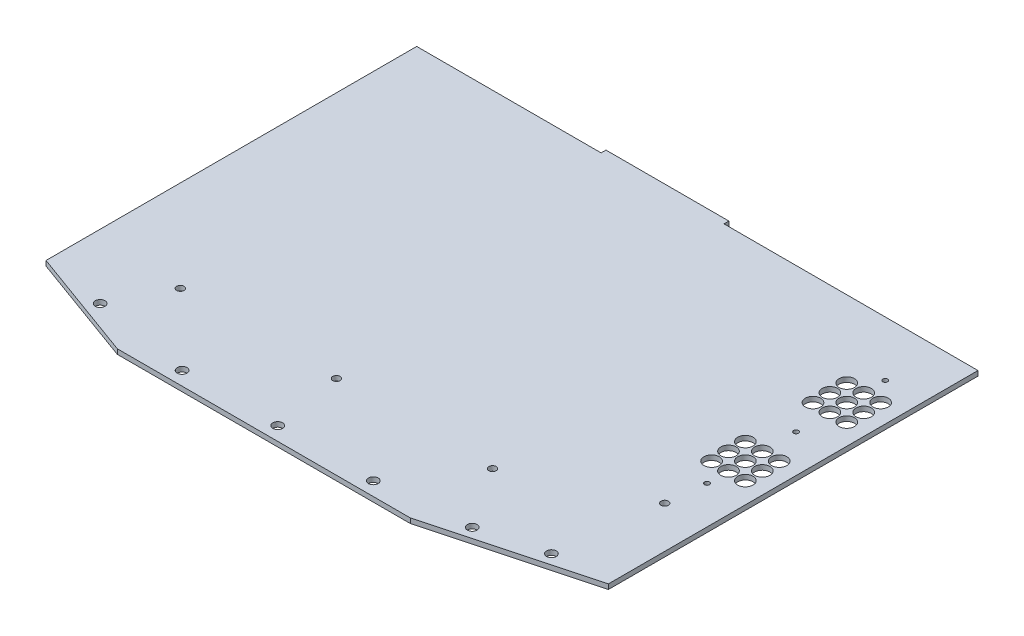
from build123d import *

# Parameters (mm, degrees)
SKETCH1_W            = 308.08168
SKETCH1_H            = 3.175
BOSS_EXTRUDE1_DEPTH  = 267.83
SKETCH3_W            = 267.83
SKETCH3_H            = 3.175
BOSS_EXTRUDE3_DEPTH  = 3.175
SKETCH4_W            = 50.8889
SKETCH4_H            = 3.175
BOSS_EXTRUDE4_DEPTH  = 267.83
CUT_EXTRUDE1_DEPTH   = 340.191055801
SKETCH17_W           = 267.83
SKETCH17_H           = 3.175
BOSS_EXTRUDE5_DEPTH  = 3.175
CUT_EXTRUDE3_DEPTH   = 340.191055801
SKETCH25_R           = 3.175
CUT_EXTRUDE8_DEPTH   = 3.175
SKETCH27_R           = 5
CUT_EXTRUDE9_DEPTH   = 340.191055801
SKETCH30_W           = 80
SKETCH30_H           = 3.175
BOSS_EXTRUDE6_DEPTH  = 3.175
SKETCH31_R           = 1.5875
CUT_EXTRUDE10_DEPTH  = 340.191055801
LPATTERN1_COUNT      = 3
LPATTERN1_PITCH      = 58
M4_CLEARANCE_HOLE1_D = 4.8


with BuildPart() as part:
    # Sketch1 → Boss-Extrude1 (new body)
    with BuildSketch(Plane.XY):
        Rectangle(SKETCH1_W, SKETCH1_H)
    extrude(amount=BOSS_EXTRUDE1_DEPTH)

    # Sketch3 → Boss-Extrude3 (add)
    with BuildSketch(Plane(origin=(154.04084, 0, 0), x_dir=(0, 0, -1), z_dir=(1, 0, 0))):
        with Locations((-133.915, 0)):
            Rectangle(SKETCH3_W, SKETCH3_H)
    extrude(amount=BOSS_EXTRUDE3_DEPTH)

    # Sketch4 → Boss-Extrude4 (add)
    with BuildSketch(Plane.XY.offset(267.83)):
        with Locations((182.66029, 0)):
            Rectangle(SKETCH4_W, SKETCH4_H)
    extrude(amount=-BOSS_EXTRUDE4_DEPTH)

    # Sketch6 → Cut-Extrude1 (cut, through all)
    with BuildSketch(Plane(origin=(0, 1.5875, 0), x_dir=(1, 0, 0), z_dir=(0, 1, 0))):
        Polygon((208.10474, -240.606362049), (106.50474, -267.83), (208.10474, -267.83), align=None)
    extrude(amount=-CUT_EXTRUDE1_DEPTH, mode=Mode.SUBTRACT)

    # Sketch17 → Boss-Extrude5 (add)
    with BuildSketch(Plane.ZY.offset(154.04084)):
        with Locations((133.915, 0)):
            Rectangle(SKETCH17_W, SKETCH17_H)
    extrude(amount=BOSS_EXTRUDE5_DEPTH)

    # Sketch11 → Cut-Extrude3 (cut, through all)
    with BuildSketch(Plane.XZ.offset(1.5875)):
        Polygon((-157.21584, 241.2743), (-84.254653892, 267.83), (-157.21584, 267.83), align=None)
    extrude(amount=-CUT_EXTRUDE3_DEPTH, mode=Mode.SUBTRACT)

    # Sketch25 → Cut-Extrude8 (cut)
    with BuildSketch(Plane.XZ.offset(1.5875)):
        with Locations(Location((-115.322188641, 247.921359373, 0), (0, 0, 270))):
            Circle(SKETCH25_R)
        with Locations(Location((-50.97526, 258.94, 0), (0, 0, 270))):
            Circle(SKETCH25_R)
        with Locations(Location((11.25474, 258.94, 0), (0, 0, 270))):
            Circle(SKETCH25_R)
        with Locations(Location((73.48474, 258.94, 0), (0, 0, 270))):
            Circle(SKETCH25_R)
        with Locations(Location((172.54474, 242.09298883, 0), (0, 0, 270))):
            Circle(SKETCH25_R)
        with Locations(Location((131.90474, 252.982444011, 0), (0, 0, 270))):
            Circle(SKETCH25_R)
    extrude(amount=-CUT_EXTRUDE8_DEPTH, mode=Mode.SUBTRACT)

    # Sketch27 → Cut-Extrude9 (cut, through all)
    with BuildSketch(Plane.XZ.offset(1.5875)):
        with Locations(Location((172.48674, 137.774823778, 0), (0, 0, 270))):
            Circle(SKETCH27_R)
        with Locations(Location((183.48674, 137.774823778, 0), (0, 0, 270))):
            Circle(SKETCH27_R)
        with Locations(Location((194.48674, 137.774823778, 0), (0, 0, 270))):
            Circle(SKETCH27_R)
        with Locations(Location((194.48674, 126.774823778, 0), (0, 0, 270))):
            Circle(SKETCH27_R)
        with Locations(Location((194.48674, 115.774823778, 0), (0, 0, 270))):
            Circle(SKETCH27_R)
        with Locations(Location((183.48674, 126.774823778, 0), (0, 0, 270))):
            Circle(SKETCH27_R)
        with Locations(Location((183.48674, 115.774823778, 0), (0, 0, 270))):
            Circle(SKETCH27_R)
        with Locations(Location((172.48674, 115.774823778, 0), (0, 0, 270))):
            Circle(SKETCH27_R)
        with Locations(Location((172.48674, 126.774823778, 0), (0, 0, 270))):
            Circle(SKETCH27_R)
        with Locations(Location((194.48674, 71.774823778, 0), (0, 0, 270))):
            Circle(SKETCH27_R)
        with Locations(Location((194.48674, 60.774823778, 0), (0, 0, 270))):
            Circle(SKETCH27_R)
        with Locations(Location((194.48674, 49.774823778, 0), (0, 0, 270))):
            Circle(SKETCH27_R)
        with Locations(Location((183.48674, 71.774823778, 0), (0, 0, 270))):
            Circle(SKETCH27_R)
        with Locations(Location((183.48674, 60.774823778, 0), (0, 0, 270))):
            Circle(SKETCH27_R)
        with Locations(Location((183.48674, 49.774823778, 0), (0, 0, 270))):
            Circle(SKETCH27_R)
        with Locations(Location((172.48674, 49.774823778, 0), (0, 0, 270))):
            Circle(SKETCH27_R)
        with Locations(Location((172.48674, 60.774823778, 0), (0, 0, 270))):
            Circle(SKETCH27_R)
        with Locations(Location((172.48674, 71.774823778, 0), (0, 0, 270))):
            Circle(SKETCH27_R)
    extrude(amount=-CUT_EXTRUDE9_DEPTH, mode=Mode.SUBTRACT)

    # Sketch30 → Boss-Extrude6 (add)
    with BuildSketch(Plane(origin=(0, 0, 0), x_dir=(-1, 0, 0), z_dir=(0, 0, -1))):
        with Locations((-2.78399998, 0)):
            Rectangle(SKETCH30_W, SKETCH30_H)
    extrude(amount=BOSS_EXTRUDE6_DEPTH)

    # Sketch31 → Cut-Extrude10 (cut, symmetric)
    with BuildSketch(Plane.XZ.offset(1.5875)):
        with Locations(Location((183.48674, 151.774823778, 0), (0, 0, 270))):
            Circle(SKETCH31_R)
    cut_extrude10 = extrude(amount=CUT_EXTRUDE10_DEPTH, both=True, mode=Mode.SUBTRACT)

    # LPattern1: Cut-Extrude10 ×3
    with Locations(*[(0, 0, -i * LPATTERN1_PITCH) for i in range(1, LPATTERN1_COUNT)]):
        add(cut_extrude10, mode=Mode.SUBTRACT)

    # M4 Clearance Hole1 (through all)
    with Locations(Plane.XZ.offset(1.5875)):
        with Locations((180.96500002, 176.776), (-97.77095, 213.2849914), (3.82905, 213.2849914), (105.42905, 213.2849914)):
            Hole(M4_CLEARANCE_HOLE1_D / 2)


solid = part.part
